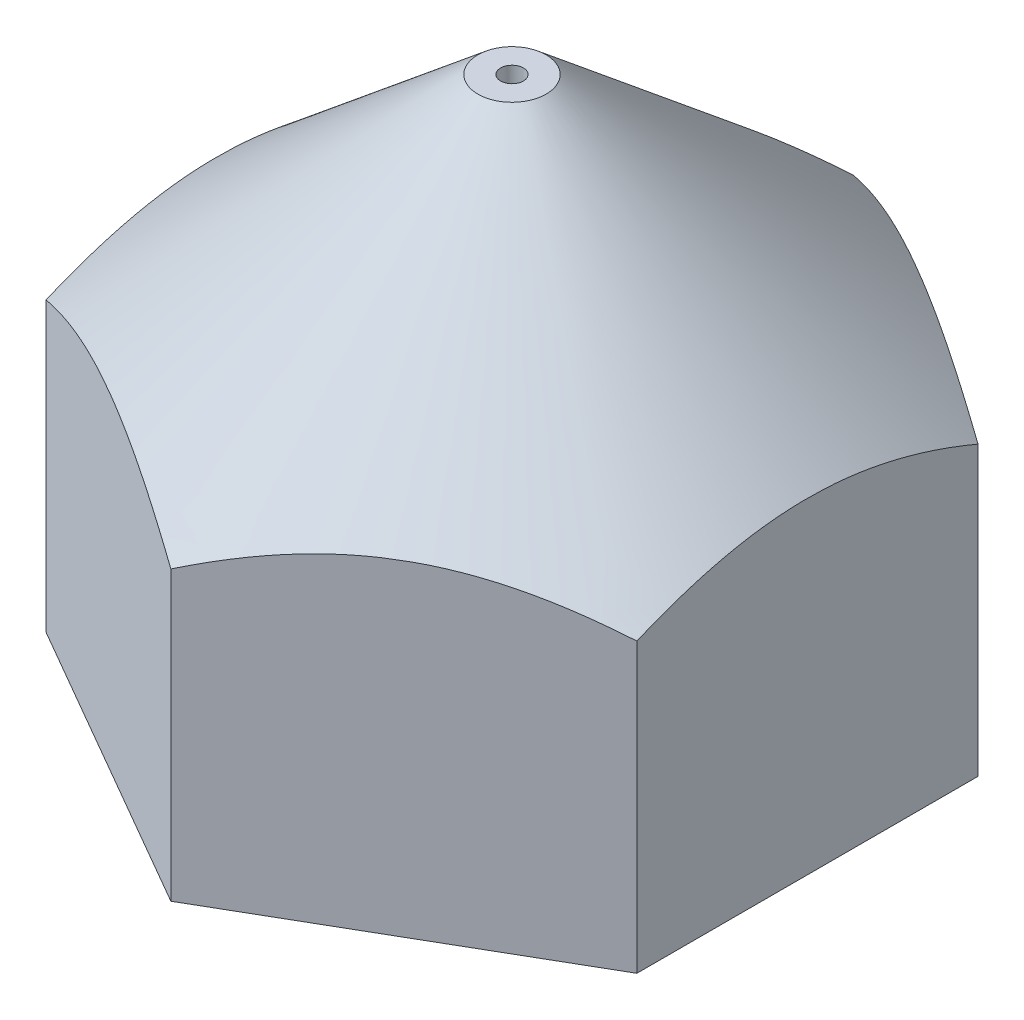
from build123d import *

# Parameters (mm, degrees)
BOSS_EXTRUDE1_DEPTH = 6
SKETCH3_R           = 0.25
CUT_EXTRUDE1_DEPTH  = 16.575086945


with BuildPart() as part:
    # Sketch1 → Boss-Extrude1 (new, symmetric)
    with BuildSketch(Plane(origin=(0, 0, 0), x_dir=(1, 0, 0), z_dir=(0, 1, 0))):
        Polygon((0, 7.505553499), (-6.5, 3.75277675), (-6.5, -3.75277675), (0, -7.505553499), (6.5, -3.75277675), (6.5, 3.75277675), align=None)
    extrude(amount=BOSS_EXTRUDE1_DEPTH, both=True)

    # Sketch2 → Cut-Revolve3 (revolve, cut)
    with BuildSketch(Plane.ZY):
        Polygon((-0.75, 6), (-7.505553499, 0.33141755), (-7.505553499, 6), align=None)
    revolve(axis=Axis((0, 0, 0), (0, 1, 0)), mode=Mode.SUBTRACT)

    # Sketch3 → Cut-Extrude1 (cut, through all)
    with BuildSketch(Plane(origin=(0, 6, 0), x_dir=(1, 0, 0), z_dir=(0, 1, 0))):
        with Locations(Location((0, 0, 0), (0, 0, 270))):
            Circle(SKETCH3_R)
    extrude(amount=-CUT_EXTRUDE1_DEPTH, mode=Mode.SUBTRACT)

    # Sketch4 → Cut-Revolve4 (revolve, cut)
    with BuildSketch(Plane(origin=(0, 0, 0), x_dir=(0, 0, -1), z_dir=(1, 0, 0))):
        Polygon((0, -6), (-5, -6), (-5, 0), (-1.8375, 0), (-1.5875, 0.25), (-1.5875, 3.232815039), (0, 5.5), align=None)
    revolve(axis=Axis((0, 6, 0), (0, -1, 0)), mode=Mode.SUBTRACT)


solid = part.part
